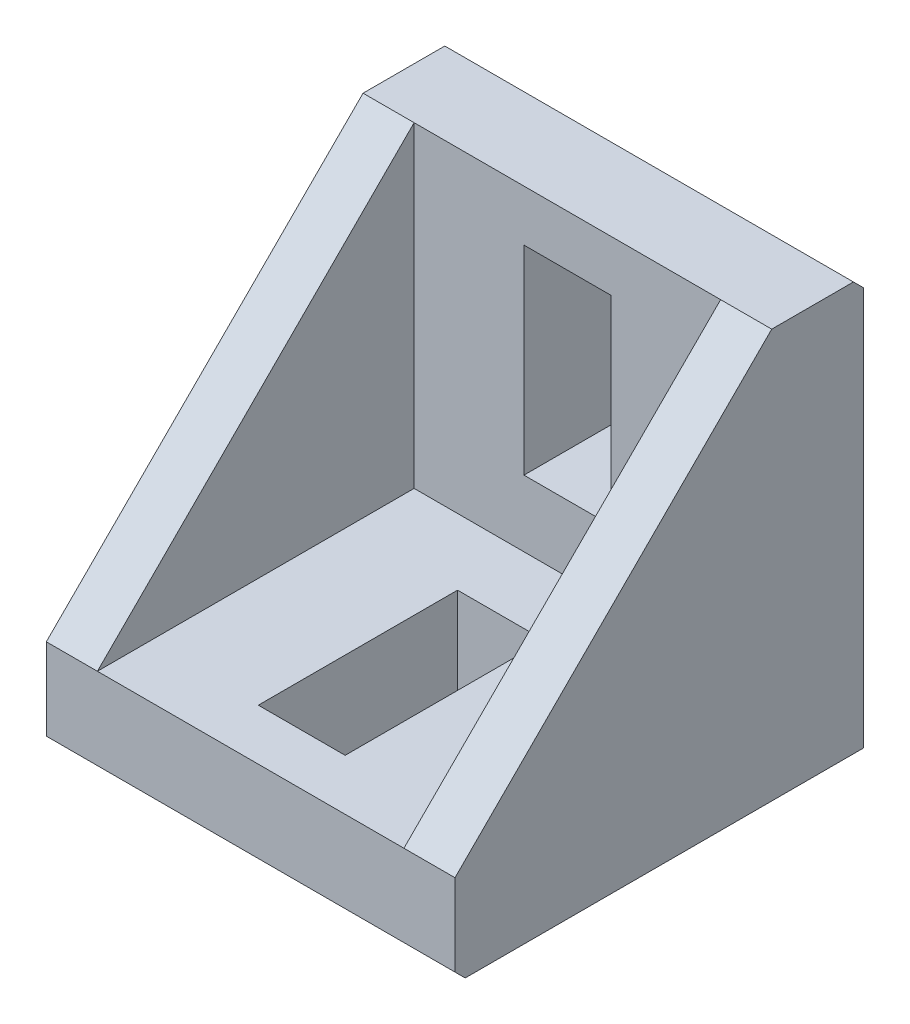
from build123d import *

# Parameters (mm, degrees)
SKETCH1_W           = 40
SKETCH1_H           = 40
BOSS_EXTRUDE1_DEPTH = 9
SKETCH2_W           = 40
SKETCH2_H           = 9
BOSS_EXTRUDE2_DEPTH = 31
SKETCH3_W           = 8.5
SKETCH3_H           = 19.5
CUT_EXTRUDE1_DEPTH  = 42.964270517
SKETCH4_W           = 8.5
SKETCH4_H           = 19.5
CUT_EXTRUDE2_DEPTH  = 55.415071442
BOSS_EXTRUDE3_DEPTH = 5
BOSS_EXTRUDE4_DEPTH = 5
CHAMFER1_SIZE       = 1


with BuildPart() as part:
    # Sketch1 → Boss-Extrude1 (new body)
    with BuildSketch(Plane(origin=(0, 0, 0), x_dir=(1, 0, 0), z_dir=(0, 1, 0))):
        Rectangle(SKETCH1_W, SKETCH1_H)
    extrude(amount=BOSS_EXTRUDE1_DEPTH)

    # Sketch2 → Boss-Extrude2 (add)
    with BuildSketch(Plane(origin=(0, 9, 0), x_dir=(1, 0, 0), z_dir=(0, 1, 0))):
        with Locations((0, 15.5)):
            Rectangle(SKETCH2_W, SKETCH2_H)
    extrude(amount=BOSS_EXTRUDE2_DEPTH)

    # Sketch3 → Cut-Extrude1 (cut, through all)
    with BuildSketch(Plane(origin=(0, 9, 0), x_dir=(1, 0, 0), z_dir=(0, 1, 0))):
        with Locations((0, -5.25)):
            Rectangle(SKETCH3_W, SKETCH3_H)
    extrude(amount=-CUT_EXTRUDE1_DEPTH, mode=Mode.SUBTRACT)

    # Sketch4 → Cut-Extrude2 (cut, through all)
    with BuildSketch(Plane.XY.offset(-11)):
        with Locations((0, 25.25)):
            Rectangle(SKETCH4_W, SKETCH4_H)
    extrude(amount=-CUT_EXTRUDE2_DEPTH, mode=Mode.SUBTRACT)

    # Sketch5 → Boss-Extrude3 (add)
    with BuildSketch(Plane.ZY.offset(20)):
        Polygon((-11, 40), (20, 9), (-11, 9), align=None)
    extrude(amount=-BOSS_EXTRUDE3_DEPTH)

    # Sketch6 → Boss-Extrude4 (add)
    with BuildSketch(Plane(origin=(20, 0, 0), x_dir=(0, 0, -1), z_dir=(1, 0, 0))):
        Polygon((-20, 9), (11, 40), (11, 9), align=None)
    extrude(amount=-BOSS_EXTRUDE4_DEPTH)

    # Chamfer1
    chamfer1_edges = [part.edges().sort_by_distance(p)[0] for p in [
        (0, 40, -20),
        (0, 0, 20),
    ]]
    chamfer(chamfer1_edges, length=CHAMFER1_SIZE)


solid = part.part
